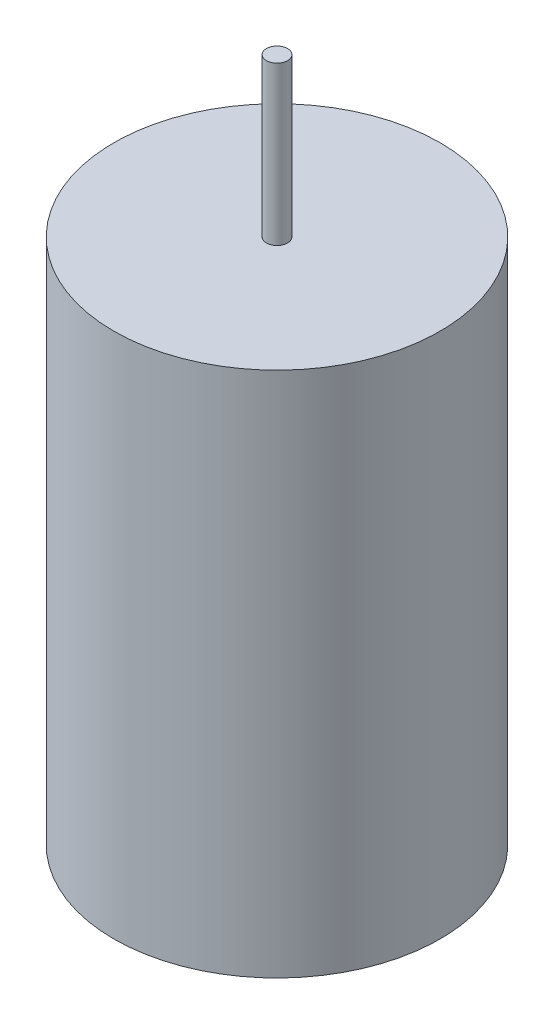
from build123d import *

# Parameters (mm, degrees)
SKETCH1_R           = 15.5
BOSS_EXTRUDE1_DEPTH = 50
SKETCH2_R           = 1
BOSS_EXTRUDE2_DEPTH = 15


with BuildPart() as part:
    # Sketch1 → Boss-Extrude1 (new body)
    with BuildSketch(Plane(origin=(0, 0, 0), x_dir=(1, 0, 0), z_dir=(0, 1, 0))):
        with Locations(Location((0, 0, 0), (0, 0, 270))):
            Circle(SKETCH1_R)
    extrude(amount=BOSS_EXTRUDE1_DEPTH)

    # Sketch2 → Boss-Extrude2 (add)
    with BuildSketch(Plane(origin=(0, 50, 0), x_dir=(1, 0, 0), z_dir=(0, 1, 0))):
        with Locations(Location((0, 0, 0), (0, 0, 270))):
            Circle(SKETCH2_R)
    extrude(amount=BOSS_EXTRUDE2_DEPTH)


solid = part.part
